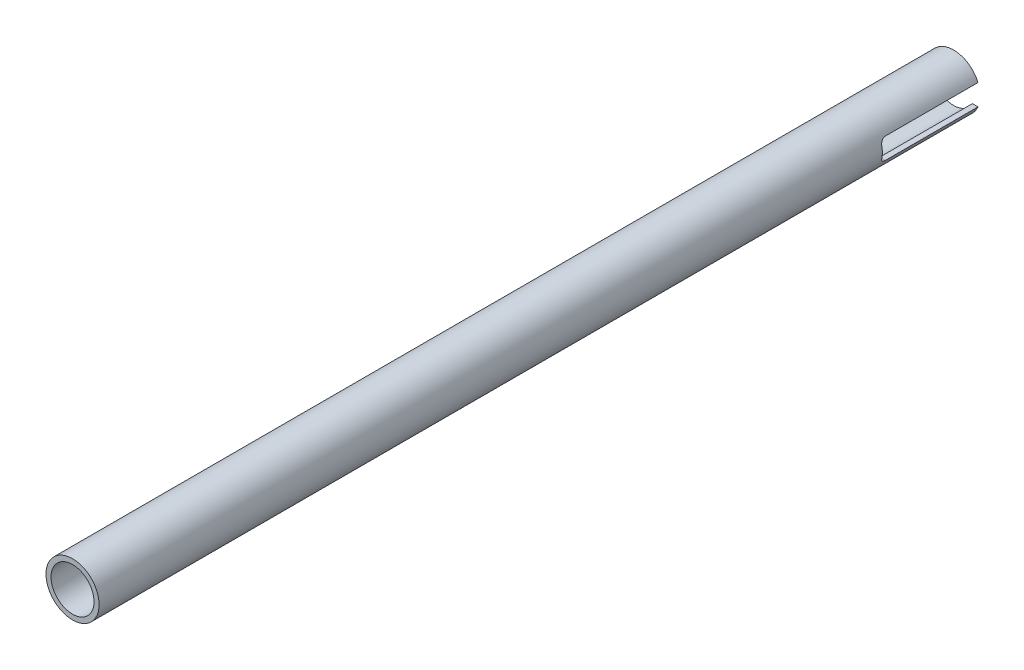
from build123d import *

# Parameters (mm, degrees)
SKETCH1_R               = 8.001
SKETCH1_R_2             = 6.477
BOSS_EXTRUDE1_DEPTH     = 265.43
CUT_EXTRUDE1_DEPTH      = 266.671068997
CUT_EXTRUDE1_DEPTH_BACK = 266.671068997


with BuildPart() as part:
    # Sketch1 → Boss-Extrude1 (new body)
    with BuildSketch(Plane.XY):
        Circle(SKETCH1_R)
        Circle(SKETCH1_R_2, mode=Mode.SUBTRACT)
    extrude(amount=BOSS_EXTRUDE1_DEPTH)

    # Sketch2 → Cut-Extrude1 (cut, two sides: drawn at the far end of the back side and taken through both)
    with BuildSketch(Plane(origin=(0, 0, 0), x_dir=(0, 0, -1), z_dir=(1, 0, 0)).offset(-CUT_EXTRUDE1_DEPTH_BACK)):
        with BuildLine():
            Line((541.330360044, 3.175), (0, 3.175))
            Line((0, 3.175), (-27.94, 3.175))
            ThreePointArc((-27.94, 3.175), (-29.017630735, 2.728630735), (-29.464, 1.651))
            Line((-29.464, 1.651), (-29.464, -1.651))
            ThreePointArc((-29.464, -1.651), (-29.017630735, -2.728630735), (-27.94, -3.175))
            Line((-27.94, -3.175), (0, -3.175))
            Line((0, -3.175), (541.330360044, -3.175))
            Line((541.330360044, -3.175), (1623.991080131, -3.175))
            Line((1623.991080131, -3.175), (1623.991080131, 3.175))
            Line((1623.991080131, 3.175), (541.330360044, 3.175))
        make_face()
    extrude(amount=CUT_EXTRUDE1_DEPTH + CUT_EXTRUDE1_DEPTH_BACK, mode=Mode.SUBTRACT)


solid = part.part
